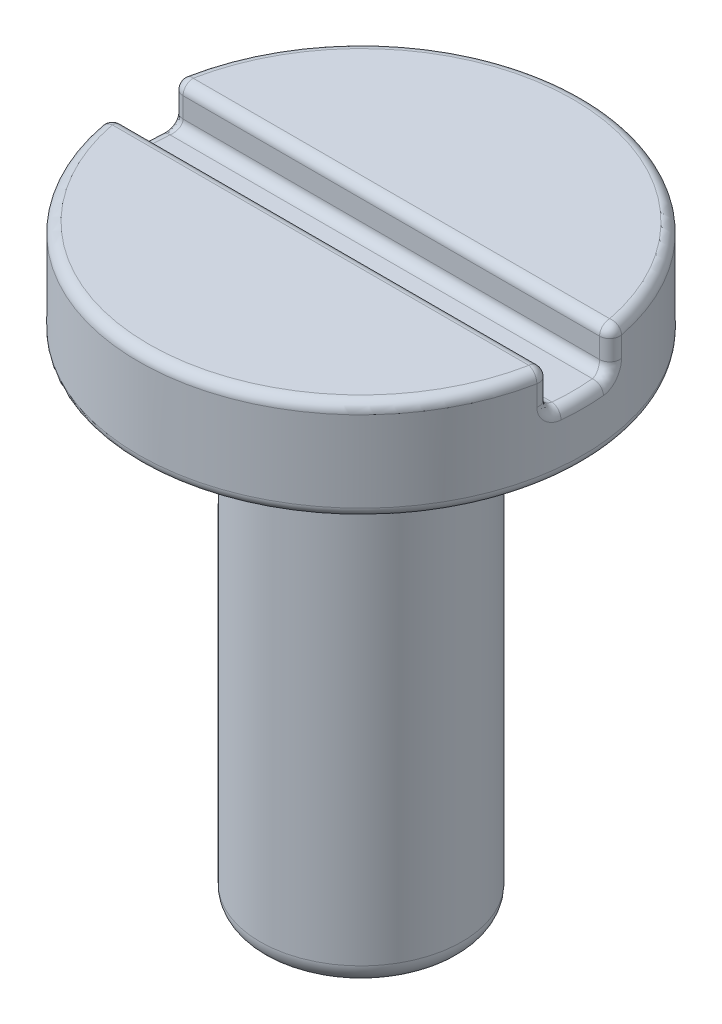
from build123d import *

# Parameters (mm, degrees)
SKETCH1_R           = 1.1
BOSS_EXTRUDE1_DEPTH = 0.5
SKETCH2_W           = 2.844413099
SKETCH2_H           = 0.3
CUT_EXTRUDE1_DEPTH  = 0.2
FILLET1_R           = 0.05
SKETCH3_R           = 0.5
BOSS_EXTRUDE2_DEPTH = 2.5
CHAMFER1_SIZE       = 0.1
CHAMFER1_SIZE2      = 0.214450692
FILLET2_R           = 0.1


with BuildPart() as part:
    # Sketch1 → Boss-Extrude1 (new body)
    with BuildSketch(Plane(origin=(0, 0, 0), x_dir=(1, 0, 0), z_dir=(0, 1, 0))):
        with Locations(Location((0, 0, 0), (0, 0, 270))):
            Circle(SKETCH1_R)
    extrude(amount=BOSS_EXTRUDE1_DEPTH)

    # Sketch2 → Cut-Extrude1 (cut)
    with BuildSketch(Plane(origin=(0, 0.5, 0), x_dir=(1, 0, 0), z_dir=(0, 1, 0))):
        with Locations((0.027526578, 0)):
            Rectangle(SKETCH2_W, SKETCH2_H)
    extrude(amount=-CUT_EXTRUDE1_DEPTH, mode=Mode.SUBTRACT)

    # Fillet1
    fillet1_edges = [part.edges().sort_by_distance(p)[0] for p in [
        (1.089724736, 0.4, -0.15),
        (0, 0.3, -0.15),
        (-1.089724736, 0.4, -0.15),
        (-1.089724736, 0.4, 0.15),
        (0, 0.3, 0.15),
        (1.089724736, 0.4, 0.15),
        (0, 0, -1.1),
        (0, 0.5, -1.1),
        (0.722841615, 0.5, 0.829156198),
        (0, 0.5, 0.15),
        (0, 0.5, -0.15),
        (-1.1, 0.3, 0),
        (1.1, 0.3, 0),
    ]]
    fillet(fillet1_edges, radius=FILLET1_R)

    # Sketch3 → Boss-Extrude2 (add)
    with BuildSketch(Plane.XZ):
        with Locations(Location((0, 0, 0), (0, 0, 90))):
            Circle(SKETCH3_R)
    extrude(amount=BOSS_EXTRUDE2_DEPTH)

    # Chamfer1
    chamfer1_edges = [part.edges().sort_by_distance(p)[0] for p in [
        (0, -2.5, -0.5),
    ]]
    chamfer1_side = [part.faces().sort_by_distance(p)[0] for p in [
        (0, -1.25, -0.5),
    ]]
    chamfer(chamfer1_edges, length=CHAMFER1_SIZE, length2=CHAMFER1_SIZE2, reference=chamfer1_side[0])

    # Fillet2
    fillet2_edges = [part.edges().sort_by_distance(p)[0] for p in [
        (0, -2.5, -0.285549308),
        (0, -2.4, -0.5),
    ]]
    fillet(fillet2_edges, radius=FILLET2_R)


solid = part.part
